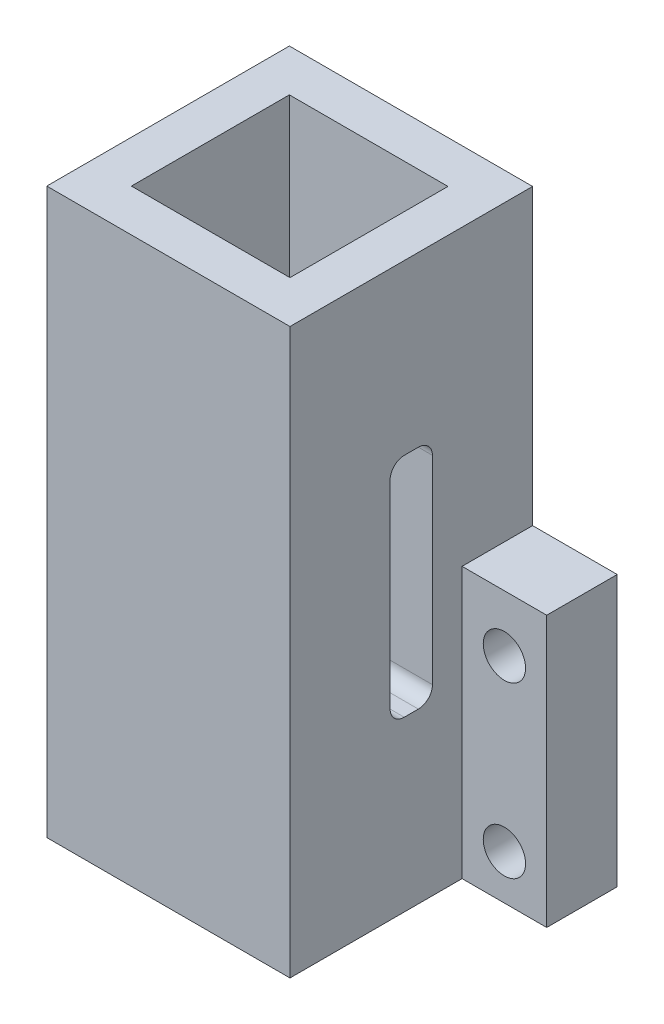
from build123d import *

# Parameters (mm, degrees)
SKETCH7_W           = 17.242861366
SKETCH7_H           = 40
BOSS_EXTRUDE1_DEPTH = 17.2
SKETCH8_W           = 29.242861366
SKETCH8_H           = 19.174682453
BOSS_EXTRUDE2_DEPTH = 5
SKETCH10_W          = 11.242861366
SKETCH10_H          = 11.2
CUT_EXTRUDE2_DEPTH  = 37
CUT_EXTRUDE3_REACH  = 43.972
SKETCH11_W          = 3
SKETCH11_H          = 16.077949268
FILLET1_R           = 1
SKETCH12_R          = 1.5
CUT_EXTRUDE4_DEPTH  = 5


with BuildPart() as part:
    # Sketch7 → Boss-Extrude1 (new body)
    with BuildSketch(Plane.XY):
        with Locations((0.869412251, 10.42274338)):
            Rectangle(SKETCH7_W, SKETCH7_H)
    extrude(amount=BOSS_EXTRUDE1_DEPTH)

    # Sketch8 → Boss-Extrude2 (add)
    with BuildSketch(Plane.XY):
        with Locations((0.869412251, 0.010084607)):
            Rectangle(SKETCH8_W, SKETCH8_H)
    extrude(amount=BOSS_EXTRUDE2_DEPTH)

    # Sketch10 → Cut-Extrude2 (cut)
    with BuildSketch(Plane(origin=(0, 30.42274338, 0), x_dir=(1, 0, 0), z_dir=(0, 1, 0))):
        with Locations((0.869412251, -8.6)):
            Rectangle(SKETCH10_W, SKETCH10_H)
    extrude(amount=-CUT_EXTRUDE2_DEPTH, mode=Mode.SUBTRACT)

    # Cut-Extrude3: up to this face of the body (flat: up to its plane)
    cut_extrude3_end = Plane(part.part.faces().sort_by_distance((9.490842934, 12.108695587, 9.587673627))[0])
    # Sketch11 → Cut-Extrude3 (cut, up to the picked face)
    with BuildSketch(Plane.ZY.offset(7.752018432), mode=Mode.PRIVATE) as cut_extrude3_sk1:
        with Locations((8.6, 10.42274338)):
            Rectangle(SKETCH11_W, SKETCH11_H)
    cut_extrude3_tool1 = split(extrude(cut_extrude3_sk1.sketch, amount=-CUT_EXTRUDE3_REACH, mode=Mode.PRIVATE), bisect_by=cut_extrude3_end, keep=Keep.BOTH, mode=Mode.PRIVATE)
    add(cut_extrude3_tool1.solids().sort_by(Axis((-7.752018, 10.422743, 8.6), (1, 0, 0)))[0], mode=Mode.SUBTRACT)

    # Fillet1
    fillet1_edges = [part.edges().sort_by_distance(p)[0] for p in [
        (7.990842934, 18.461718014, 10.1),
        (-6.252018432, 18.461718014, 10.1),
        (7.990842934, 2.383768746, 10.1),
        (-6.252018432, 2.383768746, 10.1),
        (7.990842934, 2.383768746, 7.1),
        (-6.252018432, 2.383768746, 7.1),
        (7.990842934, 18.461718014, 7.1),
        (-6.252018432, 18.461718014, 7.1),
    ]]
    fillet(fillet1_edges, radius=FILLET1_R)

    # Sketch12 → Cut-Extrude4 (cut)
    with BuildSketch(Plane.XY):
        with Locations((-10.752018432, 5.597425833)):
            Circle(SKETCH12_R)
        with Locations((-10.752018432, -6.411460604)):
            Circle(SKETCH12_R)
        with Locations(Location((12.490842934, -6.411460604, 0), (0, 0, 180))):
            Circle(SKETCH12_R)
        with Locations(Location((12.490842934, 5.597425833, 0), (0, 0, 180))):
            Circle(SKETCH12_R)
    extrude(amount=CUT_EXTRUDE4_DEPTH, mode=Mode.SUBTRACT)


solid = part.part
